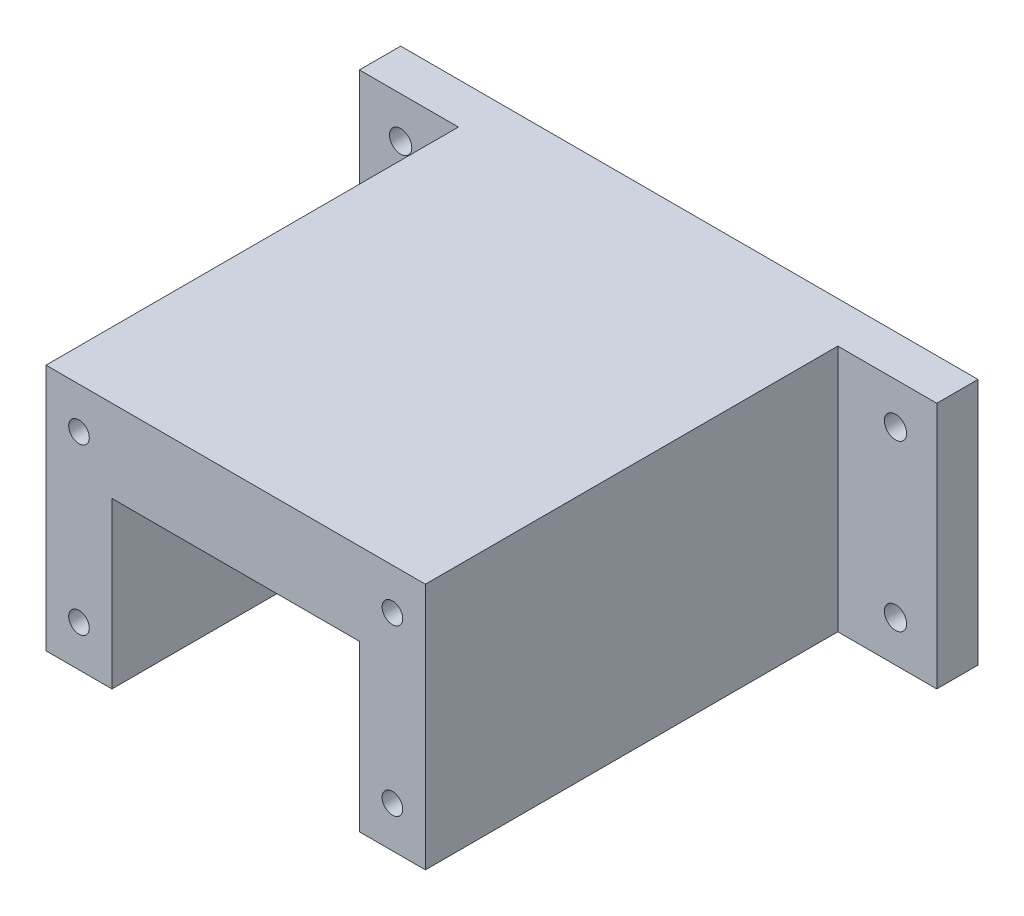
from build123d import *

# Parameters (mm, degrees)
SKETCH_1_R               = 1.35
EXTRUDE_1_DEPTH          = 5
EXTRUDE_2_DEPTH          = 50
SKETCH_3_R               = 1.25
CUT_EXTRUDE_1_DEPTH      = 10
MIRROR_2_COPY_1_SKETCH_R = 1.25
MIRROR_2_COPY_1_DEPTH    = 10
MIRROR_2_COPY_2_SKETCH_R = 1.25
MIRROR_2_COPY_2_DEPTH    = 10


with BuildPart() as part:
    # 草圖1 → 填料-伸長1 (new body)
    with BuildSketch(Plane.XY):
        Polygon((20, 0), (20, 10), (50, 10), (50, 0), (70, 0), (70, 30), (0, 30), (0, 0), align=None)
        with Locations((5, 25)):
            Circle(SKETCH_1_R, mode=Mode.SUBTRACT)
        with Locations((5, 5)):
            Circle(SKETCH_1_R, mode=Mode.SUBTRACT)
        with Locations((65, 25)):
            Circle(SKETCH_1_R, mode=Mode.SUBTRACT)
        with Locations((65, 5)):
            Circle(SKETCH_1_R, mode=Mode.SUBTRACT)
    extrude(amount=EXTRUDE_1_DEPTH)

    # 草圖2 → 填料-伸長2 (add)
    with BuildSketch(Plane.XY.offset(5)):
        Polygon((20, 20), (20, 0), (12, 0), (12, 30), (58, 30), (58, 0), (50, 0), (50, 20), align=None)
    extrude(amount=EXTRUDE_2_DEPTH)

    # 草圖3 → 除料-伸長1 (cut)
    with BuildSketch(Plane.XY.offset(55)):
        with Locations((16, 25)):
            Circle(SKETCH_3_R)
    cut_extrude_1 = extrude(amount=-CUT_EXTRUDE_1_DEPTH, mode=Mode.SUBTRACT)

    # 鏡射1: 除料-伸長1 across plane
    add(cut_extrude_1.mirror(Plane(origin=(35, 0, 0), x_dir=(0, 0, 1), z_dir=(1, 0, 0))), mode=Mode.SUBTRACT)

    # 鏡射2 copy 1 sketch → 鏡射2 copy 1 (cut)
    with BuildSketch(Plane(origin=(70, 30, 55), x_dir=(-1, 0, 0), z_dir=(0, 0, 1))):
        with Locations((16, 25)):
            Circle(MIRROR_2_COPY_1_SKETCH_R)
    extrude(amount=-MIRROR_2_COPY_1_DEPTH, mode=Mode.SUBTRACT)

    # 鏡射2 copy 2 sketch → 鏡射2 copy 2 (cut)
    with BuildSketch(Plane(origin=(0, 30, 55), x_dir=(1, 0, 0), z_dir=(0, 0, 1))):
        with Locations((16, -25)):
            Circle(MIRROR_2_COPY_2_SKETCH_R)
    extrude(amount=-MIRROR_2_COPY_2_DEPTH, mode=Mode.SUBTRACT)


solid = part.part
